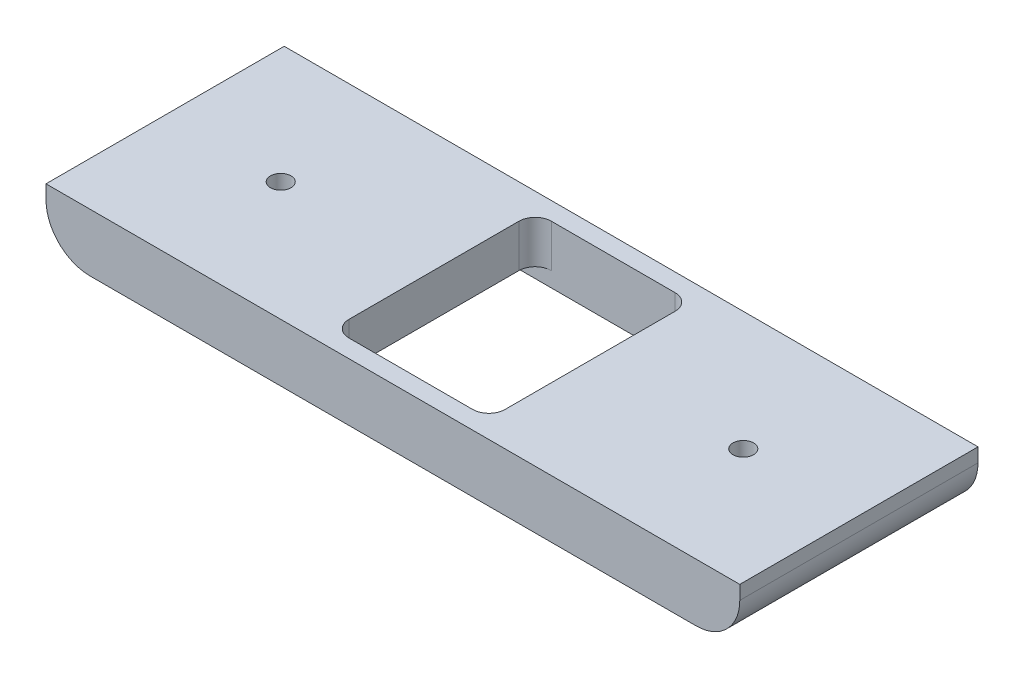
from build123d import *

# Parameters (mm, degrees)
SKETCH1_W               = 76.2
SKETCH1_H               = 26.162
BOSS_EXTRUDE1_DEPTH     = 6.35
FILLET1_R               = 4.826
SKETCH2_W               = 22.225
SKETCH2_H               = 1.651
CUT_EXTRUDE1_DEPTH      = 78.574964138
CUT_EXTRUDE2_DEPTH      = 41.556172921
CUT_EXTRUDE2_DEPTH_BACK = 41.556172921
F_4_40_TAPPED_HOLE1_D   = 2.2606


with BuildPart() as part:
    # Sketch1 → Boss-Extrude1 (new body)
    with BuildSketch(Plane(origin=(0, 0, 0), x_dir=(1, 0, 0), z_dir=(0, 1, 0))):
        Rectangle(SKETCH1_W, SKETCH1_H)
    extrude(amount=BOSS_EXTRUDE1_DEPTH)

    # Fillet1
    fillet1_edges = [part.edges().sort_by_distance(p)[0] for p in [
        (-38.1, 0, 0),
        (38.1, 0, 0),
    ]]
    fillet(fillet1_edges, radius=FILLET1_R)

    # Sketch2 → Cut-Extrude1 (cut, through all)
    with BuildSketch(Plane(origin=(38.1, 0, 0), x_dir=(0, 0, -1), z_dir=(1, 0, 0))):
        with Locations((0, 0.8255)):
            Rectangle(SKETCH2_W, SKETCH2_H)
    extrude(amount=-CUT_EXTRUDE1_DEPTH, mode=Mode.SUBTRACT)

    # Sketch3 → Cut-Extrude2 (cut, two sides: drawn at the far end of the back side and taken through both)
    with BuildSketch(Plane.XZ.offset(-1.651).offset(-CUT_EXTRUDE2_DEPTH_BACK)):
        with BuildLine():
            Line((6.7945, -11.1125), (-6.7945, -11.1125))
            ThreePointArc((-6.7945, -11.1125), (-8.051735857, -10.591735857), (-8.5725, -9.3345))
            Line((-8.5725, -9.3345), (-8.5725, 9.3345))
            ThreePointArc((-8.5725, 9.3345), (-8.051735857, 10.591735857), (-6.7945, 11.1125))
            Line((-6.7945, 11.1125), (6.7945, 11.1125))
            ThreePointArc((6.7945, 11.1125), (8.051735857, 10.591735857), (8.5725, 9.3345))
            Line((8.5725, 9.3345), (8.5725, -9.3345))
            ThreePointArc((8.5725, -9.3345), (8.051735857, -10.591735857), (6.7945, -11.1125))
        make_face()
    extrude(amount=CUT_EXTRUDE2_DEPTH + CUT_EXTRUDE2_DEPTH_BACK, mode=Mode.SUBTRACT)

    # #4-40 Tapped Hole1 (through all)
    with Locations(Plane(origin=(0, 6.35, 0), x_dir=(-1, 0, 0), z_dir=(0, 1, 0))):
        with Locations((25.4, 0), (-25.4, 0)):
            Hole(F_4_40_TAPPED_HOLE1_D / 2)


solid = part.part
